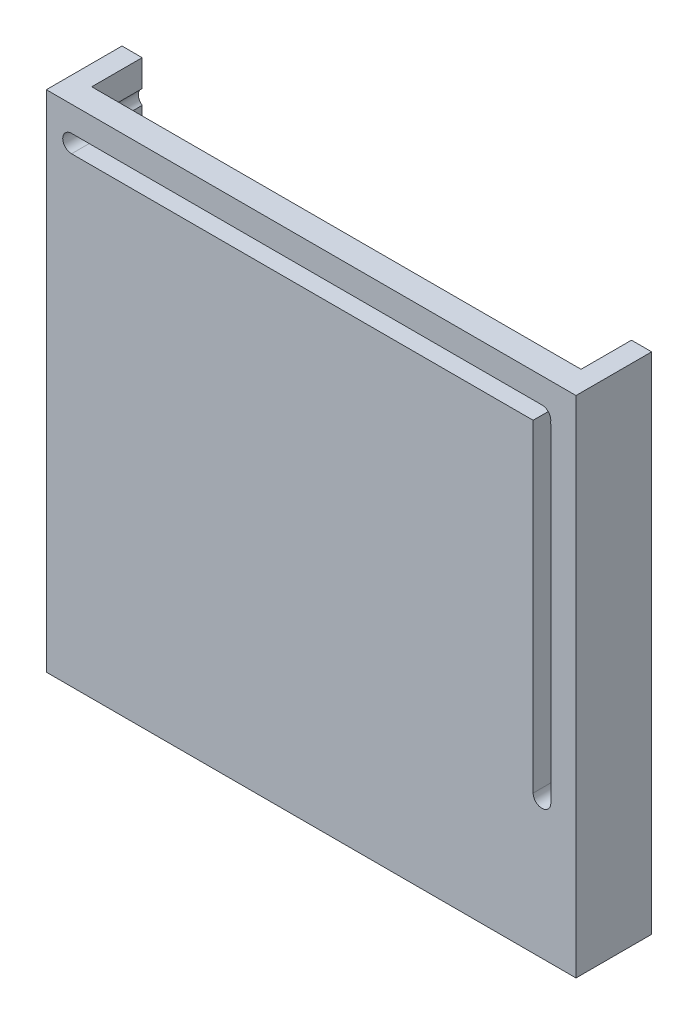
from build123d import *

# Parameters (mm, degrees)
SKETCH1_W           = 210
SKETCH1_H           = 200
BOSS_EXTRUDE1_DEPTH = 30
SKETCH2_W           = 194
SKETCH2_H           = 20
CUT_EXTRUDE1_DEPTH  = 228.870577302
CUT_EXTRUDE2_DEPTH  = 149.07092895
CUT_EXTRUDE3_DEPTH  = 149.07092895
SKETCH5_R           = 2.5
CUT_EXTRUDE4_DEPTH  = 10


with BuildPart() as part:
    # Sketch1 → Boss-Extrude1 (new body)
    with BuildSketch(Plane.XY):
        Rectangle(SKETCH1_W, SKETCH1_H)
    extrude(amount=BOSS_EXTRUDE1_DEPTH)

    # Sketch2 → Cut-Extrude1 (cut, through all)
    with BuildSketch(Plane(origin=(0, -100, 0), x_dir=(-1, 0, 0), z_dir=(0, -1, 0))):
        with Locations((0, -10)):
            Rectangle(SKETCH2_W, SKETCH2_H)
    extrude(amount=-CUT_EXTRUDE1_DEPTH, mode=Mode.SUBTRACT)

    # Sketch3 → Cut-Extrude2 (cut, through all)
    with BuildSketch(Plane.XY.offset(30)):
        with BuildLine():
            Line((88, 85), (88, -45))
            ThreePointArc((88, -45), (91.5, -48.5), (95, -45))
            Line((95, -45), (95, 85))
            ThreePointArc((95, 85), (91.5, 88.5), (88, 85))
        make_face()
    extrude(amount=-CUT_EXTRUDE2_DEPTH, mode=Mode.SUBTRACT)

    # Sketch4 → Cut-Extrude3 (cut, through all)
    with BuildSketch(Plane.XY.offset(30)):
        with BuildLine():
            Line((91.5, 83), (-95, 83))
            ThreePointArc((-95, 83), (-98.5, 86.5), (-95, 90))
            Line((-95, 90), (91.5, 90))
            ThreePointArc((91.5, 90), (95, 86.5), (91.5, 83))
        make_face()
    extrude(amount=-CUT_EXTRUDE3_DEPTH, mode=Mode.SUBTRACT)

    # Sketch5 → Cut-Extrude4 (cut)
    with BuildSketch(Plane.XZ.offset(100)):
        with Locations(Location((-6, 24.544570078, 0), (0, 0, 270))):
            Circle(SKETCH5_R)
        with Locations(Location((14, 24.544570078, 0), (0, 0, 270))):
            Circle(SKETCH5_R)
    extrude(amount=-CUT_EXTRUDE4_DEPTH, mode=Mode.SUBTRACT)


solid = part.part
